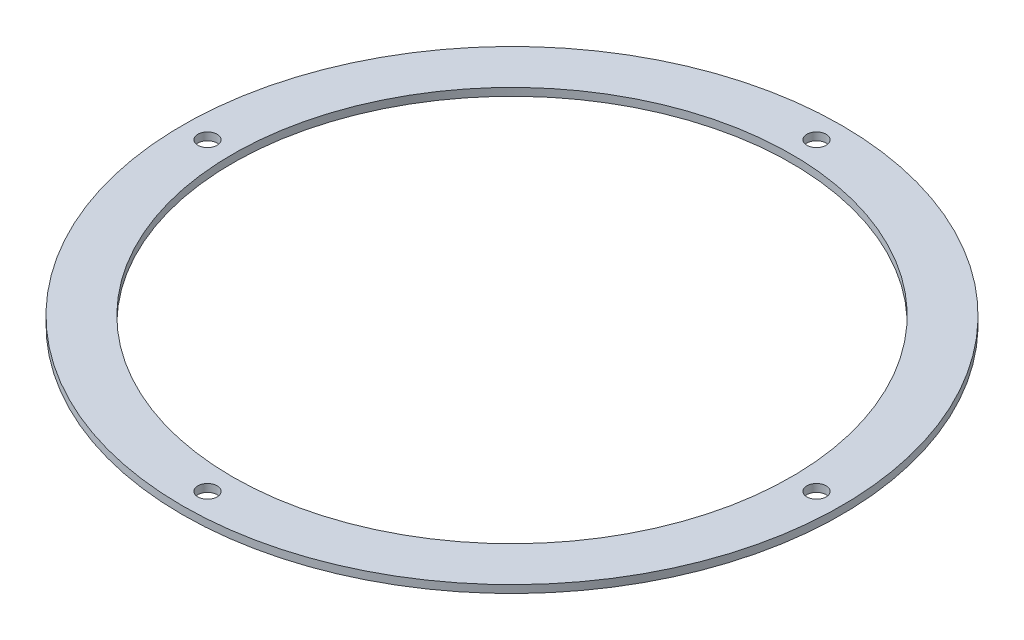
from build123d import *

# Parameters (mm, degrees)
SKETCH_1_R      = 85.5
SKETCH_1_R_2    = 72.5
SKETCH_1_R_3    = 2.5
EXTRUDE_1_DEPTH = 2


with BuildPart() as part:
    # 草图1 → 凸台-拉伸1 (new body)
    with BuildSketch(Plane(origin=(0, 0, 0), x_dir=(1, 0, 0), z_dir=(0, 1, 0))):
        with Locations(Location((0, 0, 0), (0, 0, 270))):
            Circle(SKETCH_1_R)
        with Locations(Location((0, 0, 0), (0, 0, 270))):
            Circle(SKETCH_1_R_2, mode=Mode.SUBTRACT)
        with Locations(Location((0, 79, 0), (0, 0, 270))):
            Circle(SKETCH_1_R_3, mode=Mode.SUBTRACT)
        with Locations(Location((79, 0, 0), (0, 0, 270))):
            Circle(SKETCH_1_R_3, mode=Mode.SUBTRACT)
        with Locations(Location((0, -79, 0), (0, 0, 270))):
            Circle(SKETCH_1_R_3, mode=Mode.SUBTRACT)
        with Locations(Location((-79, 0, 0), (0, 0, 270))):
            Circle(SKETCH_1_R_3, mode=Mode.SUBTRACT)
    extrude(amount=EXTRUDE_1_DEPTH)


solid = part.part
